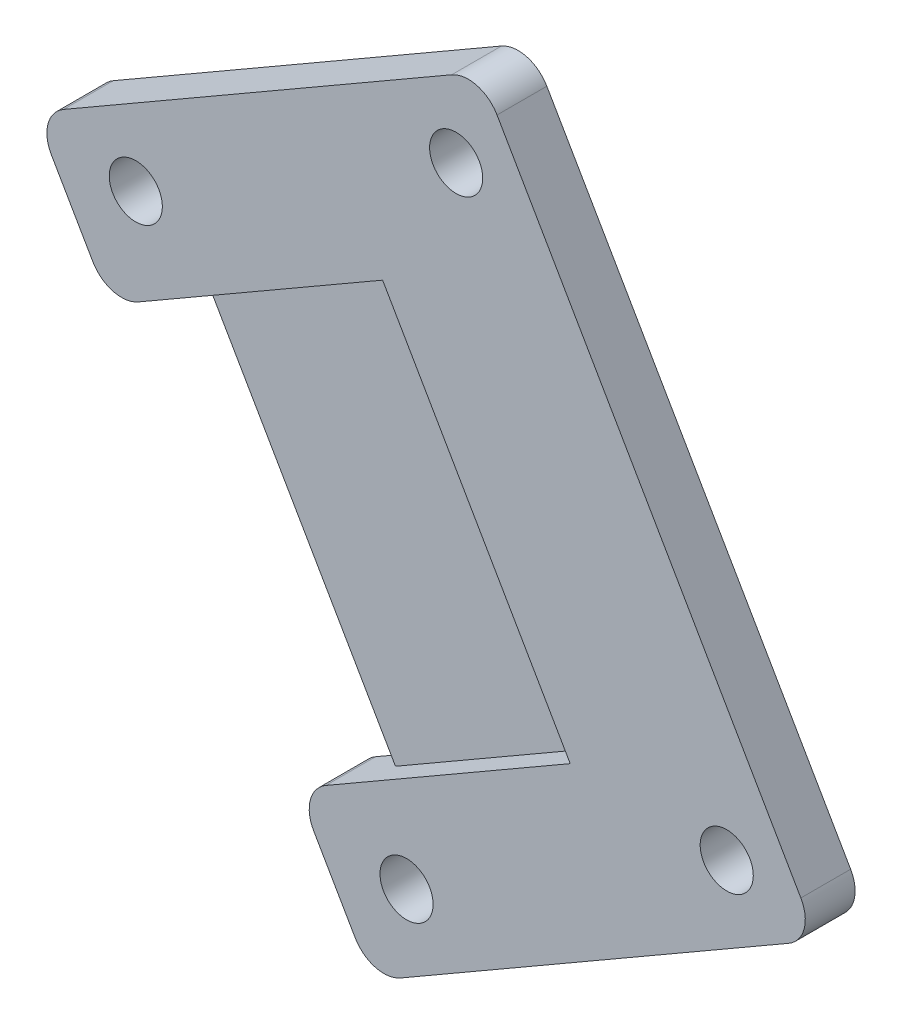
from build123d import *

# Parameters (mm, degrees)
SKETCH2_R           = 1.6
BOSS_EXTRUDE1_DEPTH = 3
FILLET1_R           = 2
CUT_EXTRUDE1_DEPTH  = 1.6


with BuildPart() as part:
    # Sketch2 → Boss-Extrude1 (new body)
    with BuildSketch(Plane.XY):
        Polygon((-77.786584036, -21.469684303), (-50.939796518, -5.969684303), (-30.639796518, -41.130315697), (-57.486584036, -56.630315697), (-61.986584036, -48.836087063), (-57.656457017, -46.336087063), (-68.956457017, -26.763912937), (-73.286584036, -29.263912937), align=None)
        with Locations((-52.403898133, -11.433785918)):
            Circle(SKETCH2_R, mode=Mode.SUBTRACT)
        with Locations((-36.103898133, -39.666214082)):
            Circle(SKETCH2_R, mode=Mode.SUBTRACT)
        with Locations((-55.390275833, -50.812719363)):
            Circle(SKETCH2_R, mode=Mode.SUBTRACT)
        with Locations((-71.70024372, -22.563026312)):
            Circle(SKETCH2_R, mode=Mode.SUBTRACT)
    extrude(amount=-BOSS_EXTRUDE1_DEPTH)

    # Fillet1
    fillet1_edges = [part.edges().sort_by_distance(p)[0] for p in [
        (-77.786584036, -21.469684303, -1.5),
        (-50.939796518, -5.969684303, -1.5),
        (-30.639796518, -41.130315697, -1.5),
        (-57.486584036, -56.630315697, -1.5),
        (-61.986584036, -48.836087063, -1.5),
        (-73.286584036, -29.263912937, -1.5),
    ]]
    fillet(fillet1_edges, radius=FILLET1_R)

    # Sketch3 → Cut-Extrude1 (cut)
    with BuildSketch(Plane.XY):
        Polygon((-68.956457017, -26.763912937), (-57.656457017, -46.336087063), (-45.532101364, -39.336087063), (-56.832101364, -19.763912937), align=None)
    extrude(amount=-CUT_EXTRUDE1_DEPTH, mode=Mode.SUBTRACT)


solid = part.part
